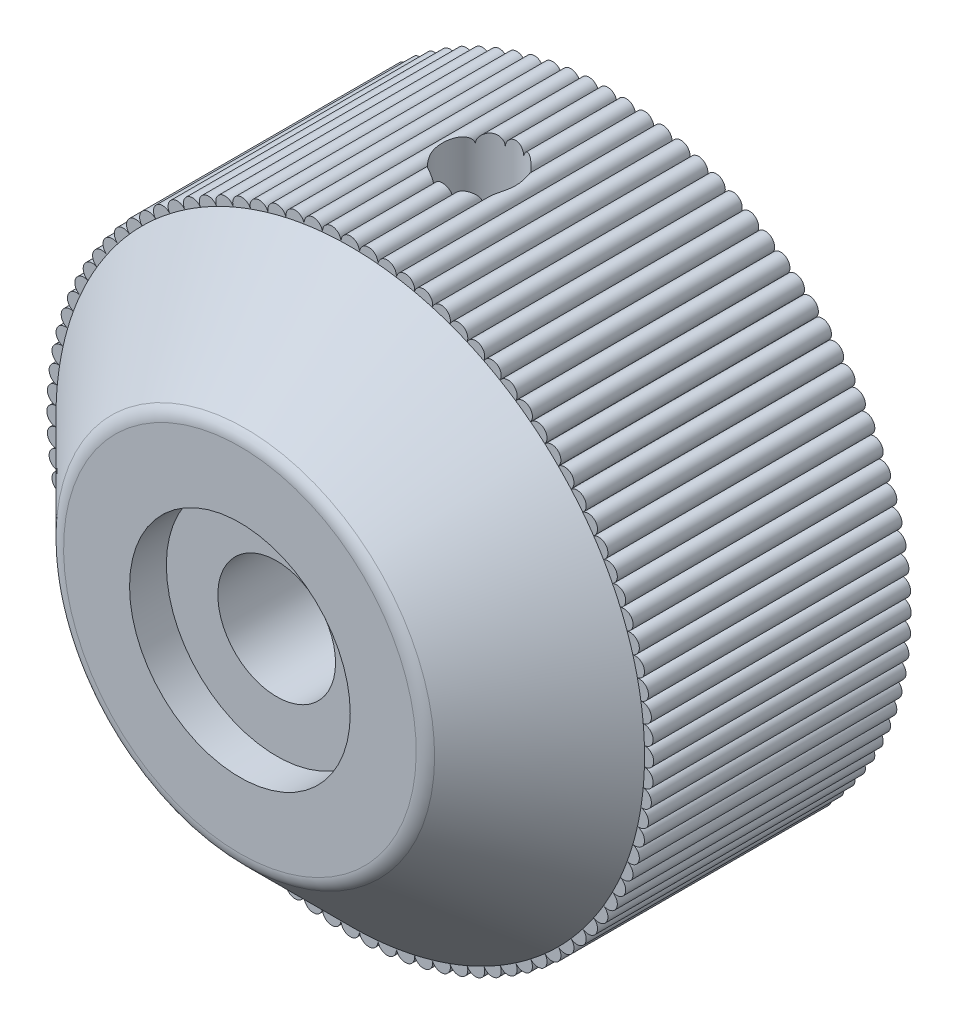
from build123d import *

# Parameters (mm, degrees)
GRIP_SKETCH_R                               = 0.25
GRIP_EXTRUDE_DEPTH                          = 7
GRIP_CIRCULAR_PATTERN_COUNT                 = 100
FASTENER_PIN_BORE_EXTRUDE_REACH             = 17.366
FASTENER_PIN_BORE_SKETCH_R                  = 1
FASTENER_PIN_BORE_EXTRUDE_DIRECTION_2_DEPTH = 5
SCREW_HEAD_HOUSING_SKETCH_R                 = 3
SCREW_HEAD_HOUSING_EXTRUDE_DEPTH            = 1
SCREW_BORE_HOLE_EXTRUDE_REACH               = 16.735
SCREW_BORE_HOLE_SKETCH_R                    = 1.6
FRONT_FILLET_R                              = 0.5


with BuildPart() as part:
    # Main Body Sketch → Main Body Revolve (revolve)
    with BuildSketch(Plane(origin=(0, 0, 0), x_dir=(0, 0, -1), z_dir=(1, 0, 0))):
        Polygon((0, 0), (-10, 0), (-10, 5), (-7, 8), (0, 8), align=None)
    revolve(axis=Axis((0, 0, 0), (0, 0, 1)))

    # Grip Sketch → Grip Extrude (add)
    with BuildSketch(Plane(origin=(0, 0, 0), x_dir=(-1, 0, 0), z_dir=(0, 0, -1))):
        with Locations((0, 8)):
            Circle(GRIP_SKETCH_R)
    grip_extrude = extrude(amount=-GRIP_EXTRUDE_DEPTH)

    # Grip Circular Pattern: Grip Extrude ×100 about axis
    grip_circular_pattern_axis = Axis((0, 0, 0), (0, 0, -1))
    for i in range(1, GRIP_CIRCULAR_PATTERN_COUNT):
        add(grip_extrude.rotate(grip_circular_pattern_axis, i * 360 / GRIP_CIRCULAR_PATTERN_COUNT))

    # Fastener Pin Bore Sketch → Fastener Pin Bore Extrude (cut, up to next)
    with BuildSketch(Plane(origin=(0, 0, 0), x_dir=(1, 0, 0), z_dir=(0, 1, 0)), mode=Mode.PRIVATE) as fastener_pin_bore_extrude_sk1:
        with Locations((0, -3.5)):
            Circle(FASTENER_PIN_BORE_SKETCH_R)
    fastener_pin_bore_extrude_tool1 = extrude(fastener_pin_bore_extrude_sk1.sketch, amount=FASTENER_PIN_BORE_EXTRUDE_REACH, mode=Mode.PRIVATE) & part.part
    add(fastener_pin_bore_extrude_tool1.solids().sort_by_distance((0, 0, 3.5))[0], mode=Mode.SUBTRACT)

    # Fastener Pin Bore Sketch → Fastener Pin Bore Extrude direction 2 (cut)
    with BuildSketch(Plane(origin=(0, 0, 0), x_dir=(1, 0, 0), z_dir=(0, 1, 0))):
        with Locations((0, -3.5)):
            Circle(FASTENER_PIN_BORE_SKETCH_R)
    extrude(amount=-FASTENER_PIN_BORE_EXTRUDE_DIRECTION_2_DEPTH, mode=Mode.SUBTRACT)

    # Screw Head Housing Sketch → Screw Head Housing Extrude (cut)
    with BuildSketch(Plane.XY.offset(10)):
        Circle(SCREW_HEAD_HOUSING_SKETCH_R)
    extrude(amount=-SCREW_HEAD_HOUSING_EXTRUDE_DEPTH, mode=Mode.SUBTRACT)

    # Screw Bore Hole Sketch → Screw Bore Hole Extrude (cut, up to next)
    with BuildSketch(Plane.XY.offset(9), mode=Mode.PRIVATE) as screw_bore_hole_extrude_sk1:
        Circle(SCREW_BORE_HOLE_SKETCH_R)
    screw_bore_hole_extrude_tool1 = extrude(screw_bore_hole_extrude_sk1.sketch, amount=-SCREW_BORE_HOLE_EXTRUDE_REACH, mode=Mode.PRIVATE) & part.part
    add(screw_bore_hole_extrude_tool1.solids().sort_by_distance((0, 0, 9))[0], mode=Mode.SUBTRACT)

    # Front Fillet
    front_fillet_edges = [part.edges().sort_by_distance(p)[0] for p in [
        (0, -5, 10),
    ]]
    fillet(front_fillet_edges, radius=FRONT_FILLET_R)


solid = part.part
